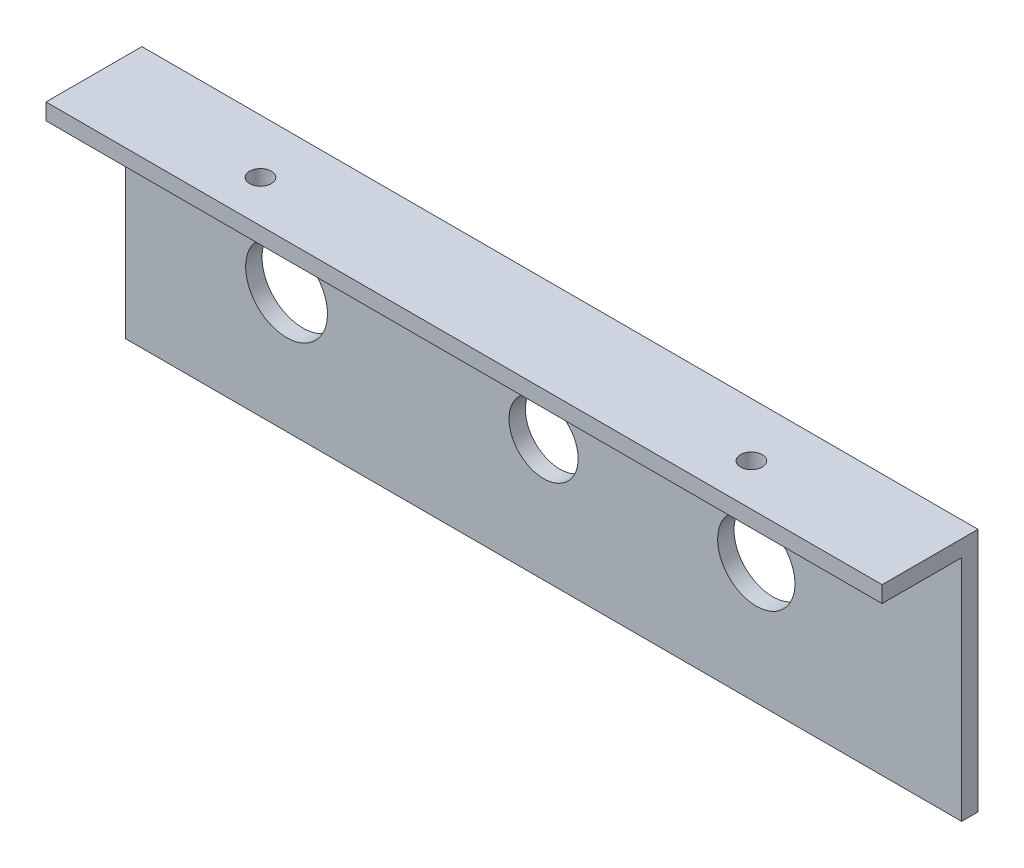
from build123d import *

# Parameters (mm, degrees)
ESQUISSE1_W             = 129.794
ESQUISSE1_H             = 37.9984
BOSS_EXTRU_1_DEPTH      = 2.54
ESQUISSE2_W             = 12.3444
ESQUISSE2_H             = 2.54
BOSS_EXTRU_2_DEPTH      = 129.794
ESQUISSE3_R             = 5.36575
ENL_V_MAT_EXTRU_1_DEPTH = 69.738449364
ESQUISSE4_R             = 1.68275
ENL_V_MAT_EXTRU_2_DEPTH = 77.661883455
ESQUISSE5_R             = 6.35
ENL_V_MAT_EXTRU_3_DEPTH = 2.54
ESQUISSE7_R             = 6
ENL_V_MAT_EXTRU_4_DEPTH = 2.54


with BuildPart() as part:
    # Esquisse1 → Boss.-Extru.1 (new body)
    with BuildSketch(Plane.XY):
        Rectangle(ESQUISSE1_W, ESQUISSE1_H)
    extrude(amount=BOSS_EXTRU_1_DEPTH)

    # Esquisse2 → Boss.-Extru.2 (add)
    with BuildSketch(Plane.ZY.offset(64.897)):
        with Locations((8.7122, 17.7292)):
            Rectangle(ESQUISSE2_W, ESQUISSE2_H)
    extrude(amount=-BOSS_EXTRU_2_DEPTH)

    # Esquisse3 → Enlèv. mat.-Extru.1 (cut, through all)
    with BuildSketch(Plane.XY.offset(2.54)):
        Circle(ESQUISSE3_R)
    extrude(amount=-ENL_V_MAT_EXTRU_1_DEPTH, mode=Mode.SUBTRACT)

    # Esquisse4 → Enlèv. mat.-Extru.2 (cut, through all)
    with BuildSketch(Plane(origin=(0, 18.9992, 0), x_dir=(1, 0, 0), z_dir=(0, 1, 0))):
        with Locations(Location((-38.1, -8.382, 0), (0, 0, 270))):
            Circle(ESQUISSE4_R)
        with Locations(Location((38.1, -8.382, 0), (0, 0, 270))):
            Circle(ESQUISSE4_R)
    extrude(amount=-ENL_V_MAT_EXTRU_2_DEPTH, mode=Mode.SUBTRACT)

    # Esquisse5 → Enlèv. mat.-Extru.3 (cut)
    with BuildSketch(Plane.XY.offset(2.54)):
        with Locations((-39.897, 0)):
            Circle(ESQUISSE5_R)
    extrude(amount=-ENL_V_MAT_EXTRU_3_DEPTH, mode=Mode.SUBTRACT)

    # Esquisse7 → Enlèv. mat.-Extru.4 (cut)
    with BuildSketch(Plane(origin=(0, 0, 0), x_dir=(-1, 0, 0), z_dir=(0, 0, -1))):
        with Locations((-33.02, 0)):
            Circle(ESQUISSE7_R)
    extrude(amount=-ENL_V_MAT_EXTRU_4_DEPTH, mode=Mode.SUBTRACT)


solid = part.part
